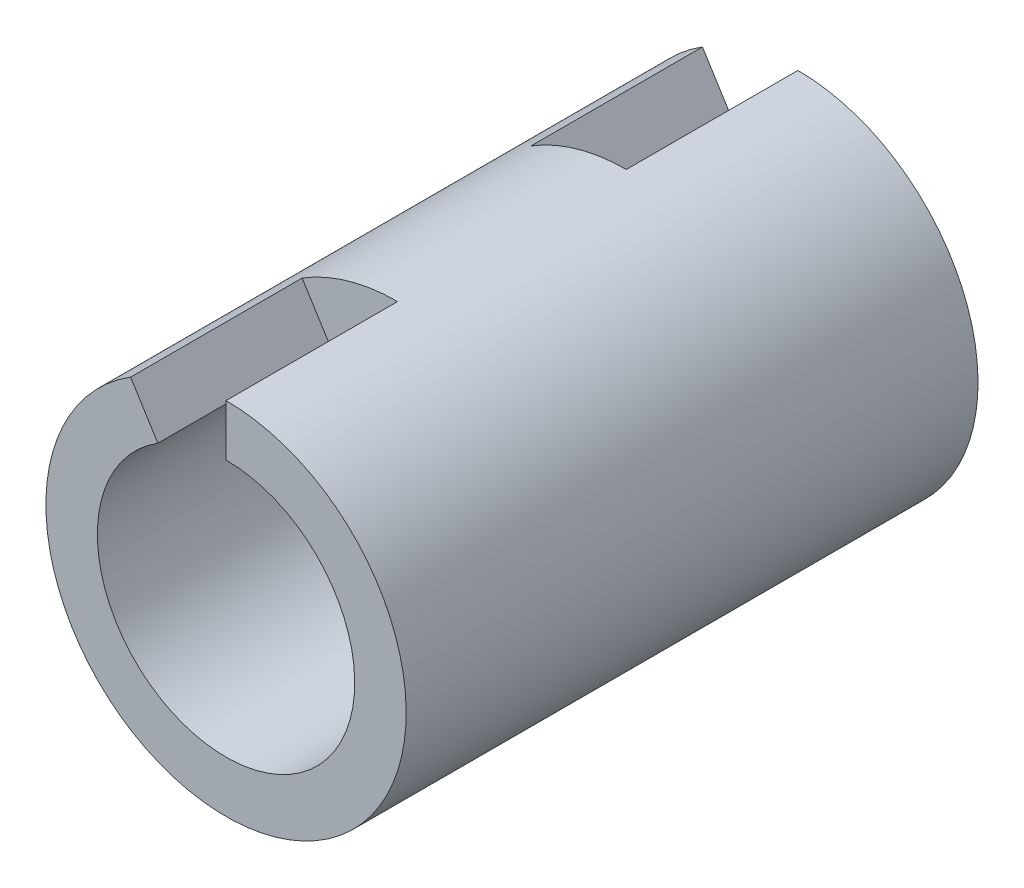
from build123d import *

# Parameters (mm, degrees)
BOSS_EXTRUDE1_DEPTH      = 10
BOSS_EXTRUDE1_DEPTH_BACK = 10
SKETCH1_R                = 6.5
SKETCH1_R_2              = 4.5
CUT_EXTRUDE2_DEPTH       = 6
CUT_EXTRUDE3_DEPTH       = 6
SKETCH4_R                = 6.5
SKETCH4_R_2              = 6.3
CUT_EXTRUDE4_DEPTH       = 23.011360703


with BuildPart() as part:
    # Sketch1 → Boss-Extrude1 (new, two sides: drawn at the far end of the back side and taken through both)
    with BuildSketch(Plane.XY.offset(-BOSS_EXTRUDE1_DEPTH_BACK)):
        Circle(SKETCH1_R)
        Circle(SKETCH1_R_2, mode=Mode.SUBTRACT)
    extrude(amount=BOSS_EXTRUDE1_DEPTH + BOSS_EXTRUDE1_DEPTH_BACK)

    # Sketch2 → Cut-Extrude2 (cut)
    with BuildSketch(Plane.XY.offset(10)):
        with BuildLine():
            Line((-6.230040483, 9.970148902), (0, 0))
            Line((0, 0), (0, 11.756584264))
            ThreePointArc((0, 11.756584264), (-3.2405538, 11.301154128), (-6.230040483, 9.970148902))
        make_face()
    extrude(amount=-CUT_EXTRUDE2_DEPTH, mode=Mode.SUBTRACT)

    # Sketch3 → Cut-Extrude3 (cut)
    with BuildSketch(Plane.XY.offset(-10)):
        with BuildLine():
            Line((-6.230040483, 9.970148902), (0, 0))
            Line((0, 0), (0, 11.756584264))
            ThreePointArc((0, 11.756584264), (-3.2405538, 11.301154128), (-6.230040483, 9.970148902))
        make_face()
    extrude(amount=CUT_EXTRUDE3_DEPTH, mode=Mode.SUBTRACT)

    # Sketch4 → Cut-Extrude4 (cut, through all)
    with BuildSketch(Plane(origin=(0, 0, -10), x_dir=(-1, 0, 0), z_dir=(0, 0, -1))):
        Circle(SKETCH4_R)
        Circle(SKETCH4_R_2, mode=Mode.SUBTRACT)
    extrude(amount=-CUT_EXTRUDE4_DEPTH, mode=Mode.SUBTRACT)


solid = part.part
